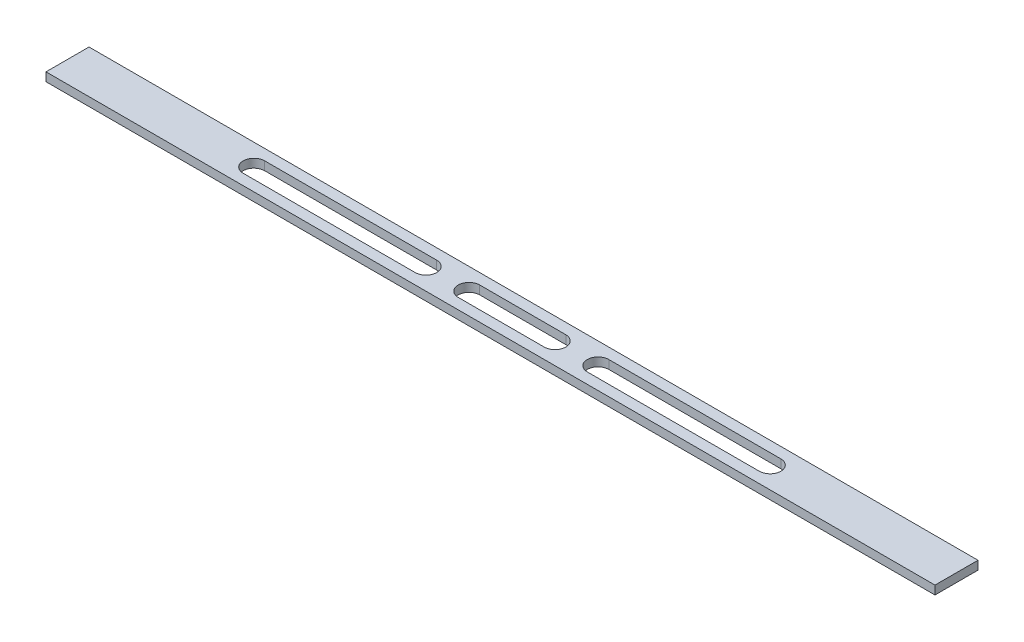
from build123d import *

# Parameters (mm, degrees)
SKETCH_1_W          = 620
SKETCH_1_H          = 30
EXTRUDE_1_DEPTH     = 6
CUT_EXTRUDE_1_DEPTH = 311.420682301


with BuildPart() as part:
    # 草图1 → 凸台-拉伸1 (new body)
    with BuildSketch(Plane(origin=(0, 0, 0), x_dir=(1, 0, 0), z_dir=(0, 1, 0))):
        Rectangle(SKETCH_1_W, SKETCH_1_H)
    extrude(amount=EXTRUDE_1_DEPTH)

    # 草图2 → 切除-拉伸1 (cut, through all)
    with BuildSketch(Plane(origin=(0, 6, 0), x_dir=(1, 0, 0), z_dir=(0, 1, 0))):
        with BuildLine():
            Line((30, -7.5), (-30, -7.5))
            ThreePointArc((-30, -7.5), (-37.5, 0), (-30, 7.5))
            Line((-30, 7.5), (30, 7.5))
            ThreePointArc((30, 7.5), (37.5, 0), (30, -7.5))
        make_face()
        with BuildLine():
            Line((-60, -7.5), (-180, -7.5))
            ThreePointArc((-180, -7.5), (-187.5, 0), (-180, 7.5))
            Line((-180, 7.5), (-60, 7.5))
            ThreePointArc((-60, 7.5), (-52.5, 0), (-60, -7.5))
        make_face()
        with BuildLine():
            Line((60, 7.5), (180, 7.5))
            ThreePointArc((180, 7.5), (187.5, 0), (180, -7.5))
            Line((180, -7.5), (60, -7.5))
            ThreePointArc((60, -7.5), (52.5, 0), (60, 7.5))
        make_face()
    extrude(amount=-CUT_EXTRUDE_1_DEPTH, mode=Mode.SUBTRACT)


solid = part.part
